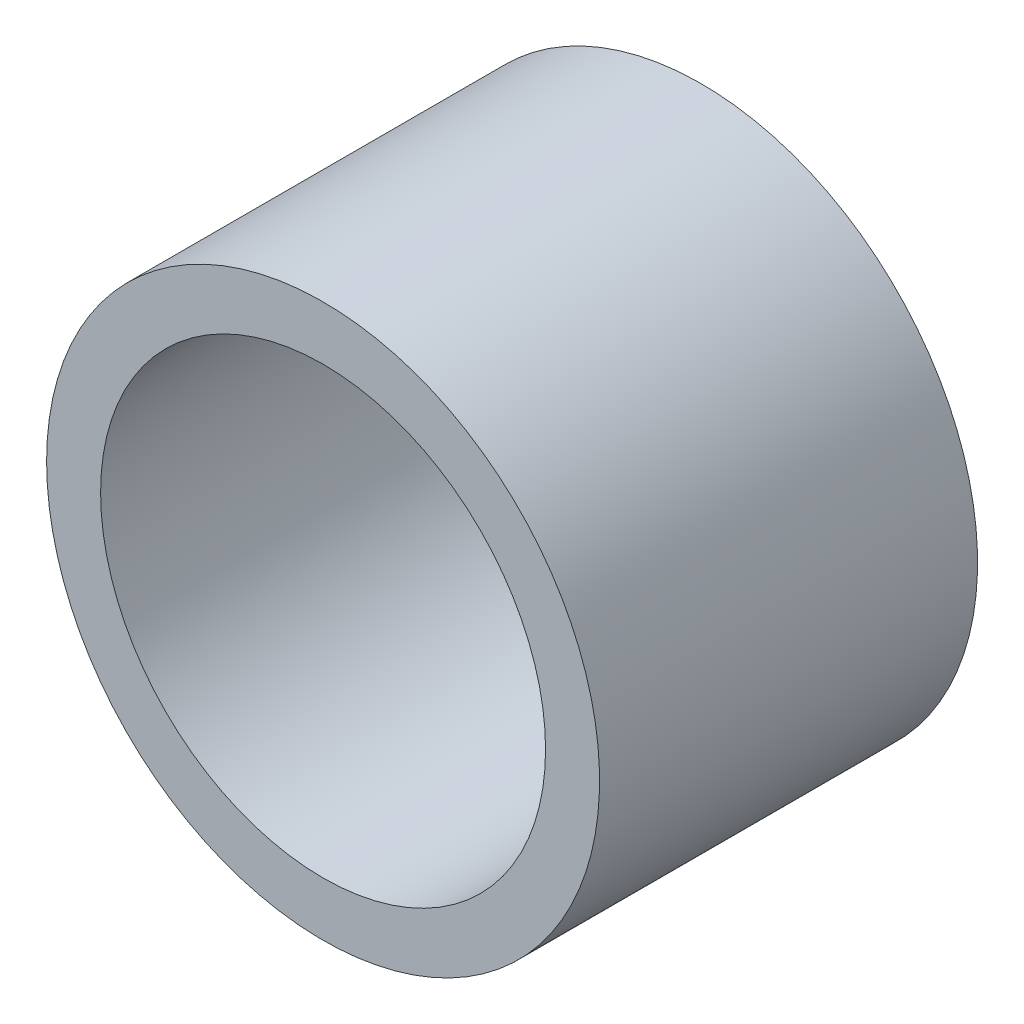
from build123d import *

# Parameters (mm, degrees)
SKETCH1_W = 44.45
SKETCH1_H = 6.35


with BuildPart() as part:
    # Sketch1 → Revolve1 (revolve)
    with BuildSketch(Plane(origin=(0, 0, 0), x_dir=(0, 0, -1), z_dir=(1, 0, 0)), mode=Mode.PRIVATE) as revolve1_sk:
        with Locations((-22.225, 29.337)):
            Rectangle(SKETCH1_W, SKETCH1_H)
    revolve(revolve1_sk.sketch.rotate(Axis((0, 0, 0), (0, 0, 1)), 90), axis=Axis((0, 0, 0), (0, 0, 1)))


solid = part.part
